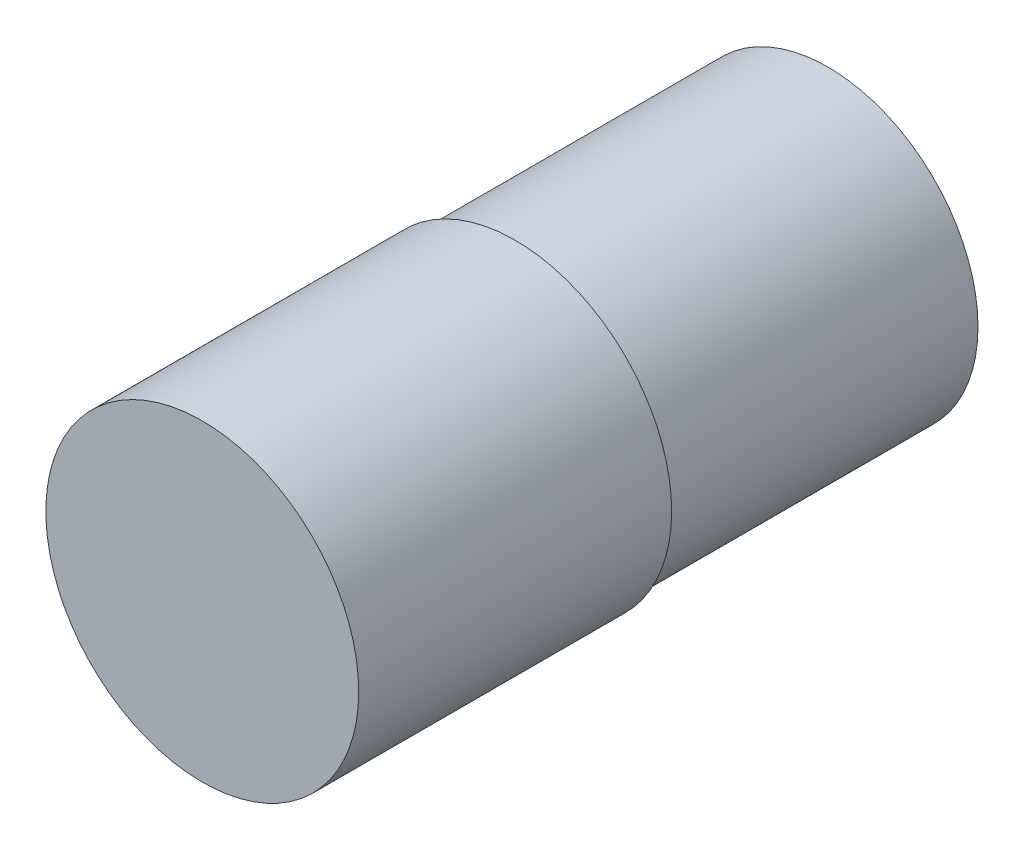
from build123d import *

# Parameters (mm, degrees)
SKETCH1_R           = 2.3
BOSS_EXTRUDE1_DEPTH = 4.8
SKETCH2_R           = 2.4
BOSS_EXTRUDE2_DEPTH = 4.8


with BuildPart() as part:
    # Sketch1 → Boss-Extrude1 (new body)
    with BuildSketch(Plane.XY):
        Circle(SKETCH1_R)
    extrude(amount=BOSS_EXTRUDE1_DEPTH)

    # Sketch2 → Boss-Extrude2 (add)
    with BuildSketch(Plane.XY.offset(4.8)):
        Circle(SKETCH2_R)
    extrude(amount=BOSS_EXTRUDE2_DEPTH)


solid = part.part
